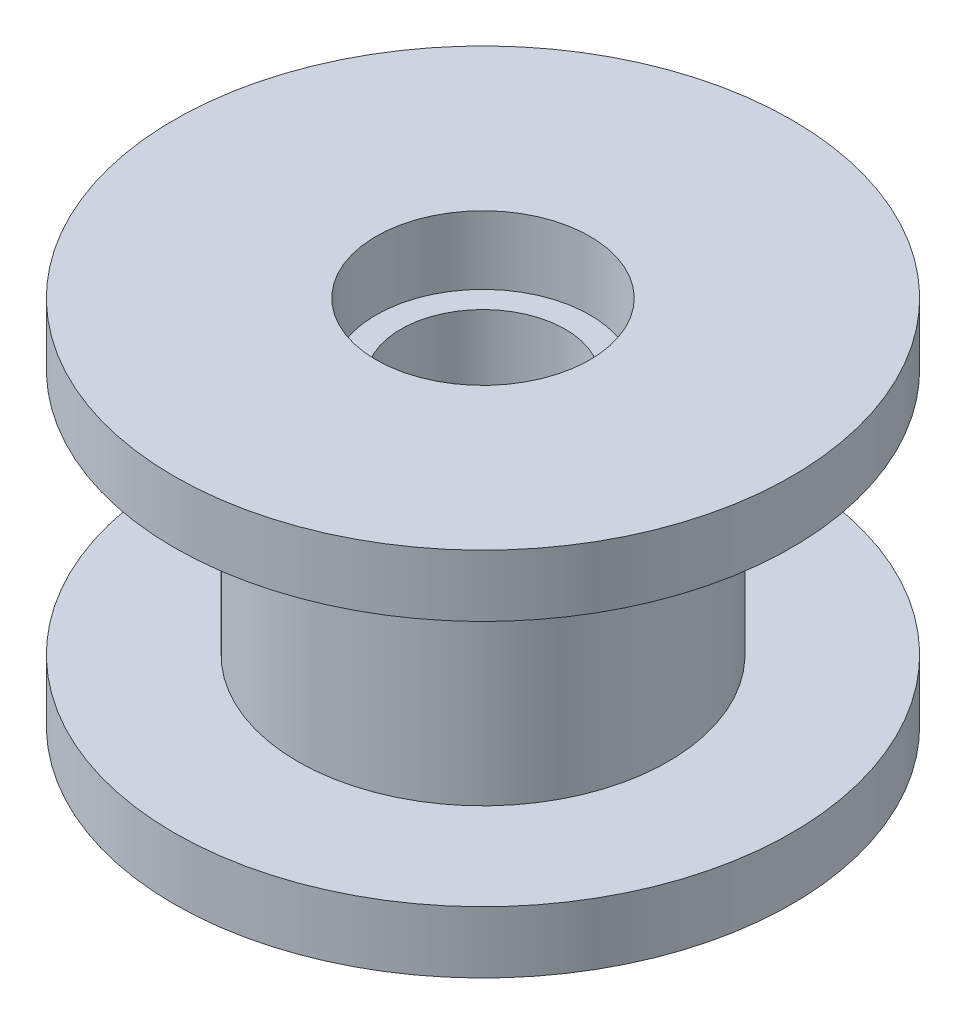
from build123d import *

# Parameters (mm, degrees)
SKETCH1_R               = 31.75
BOSS_EXTRUDE1_DEPTH     = 19.05
SKETCH2_R               = 31.75
SKETCH2_R_2             = 19.05
CUT_EXTRUDE_THIN1_DEPTH = 12.7
CUT_EXTRUDE1_DEPTH      = 49.775275499
CUT_EXTRUDE1_DEPTH_BACK = 49.775275499
SKETCH3_R               = 11
SKETCH6_R               = 11
SKETCH6_R_2             = 8.46
EXTRUDE_THIN1_DEPTH     = 12.05


with BuildPart() as part:
    # Sketch1 → Boss-Extrude1 (new, symmetric)
    with BuildSketch(Plane(origin=(0, 0, 0), x_dir=(1, 0, 0), z_dir=(0, 1, 0))):
        Circle(SKETCH1_R)
    extrude(amount=BOSS_EXTRUDE1_DEPTH, both=True)

    # Sketch2 → Cut-Extrude-Thin1 (cut, symmetric)
    with BuildSketch(Plane(origin=(0, 0, 0), x_dir=(1, 0, 0), z_dir=(0, 1, 0))):
        Circle(SKETCH2_R)
        Circle(SKETCH2_R_2, mode=Mode.SUBTRACT)
    extrude(amount=CUT_EXTRUDE_THIN1_DEPTH, both=True, mode=Mode.SUBTRACT)

    # Sketch3 → Cut-Extrude1 (cut, two sides: drawn at the far end of the back side and taken through both)
    with BuildSketch(Plane(origin=(0, 0, 0), x_dir=(1, 0, 0), z_dir=(0, 1, 0)).offset(-CUT_EXTRUDE1_DEPTH_BACK)):
        Circle(SKETCH3_R)
    extrude(amount=CUT_EXTRUDE1_DEPTH + CUT_EXTRUDE1_DEPTH_BACK, mode=Mode.SUBTRACT)

    # Sketch6 → Extrude-Thin1 (add, symmetric)
    with BuildSketch(Plane(origin=(0, 0, 0), x_dir=(1, 0, 0), z_dir=(0, 1, 0))):
        Circle(SKETCH6_R)
        Circle(SKETCH6_R_2, mode=Mode.SUBTRACT)
    extrude(amount=EXTRUDE_THIN1_DEPTH, both=True)


solid = part.part
